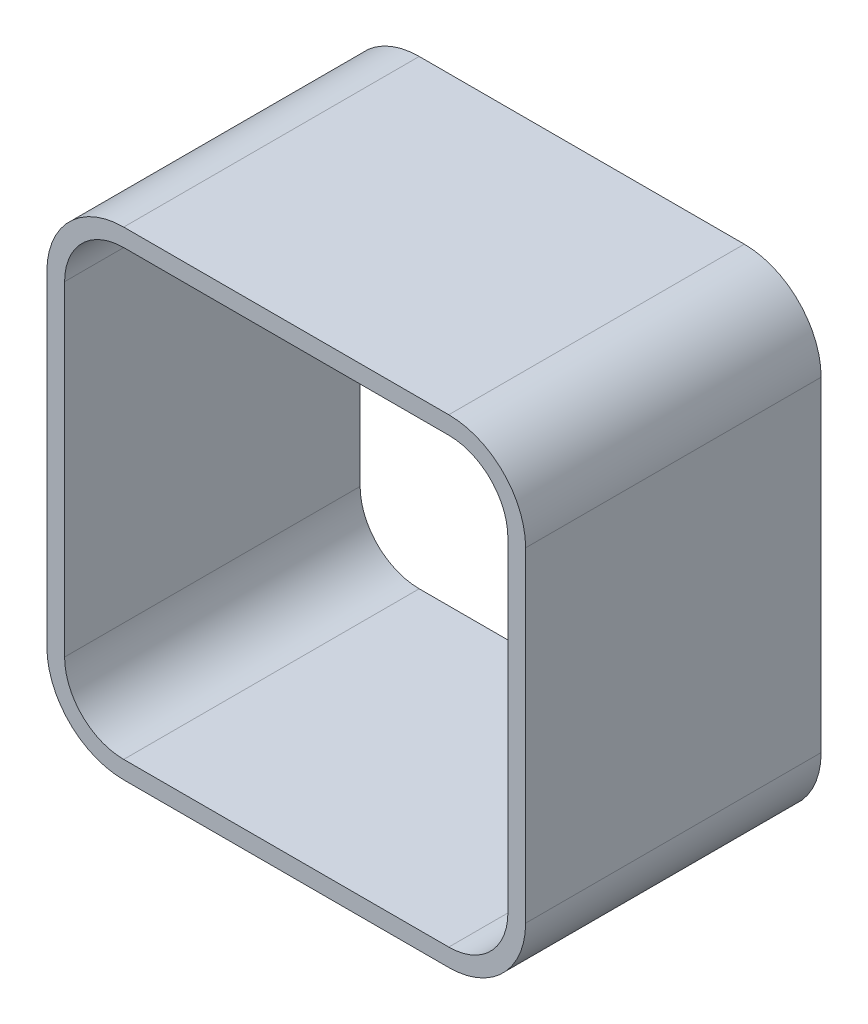
from build123d import *

# Parameters (mm, degrees)
SKETCH1_W           = 16.2
SKETCH1_H           = 16.2
SKETCH1_W_2         = 15
SKETCH1_H_2         = 15
BOSS_EXTRUDE1_DEPTH = 10
FILLET1_R           = 2
FILLET2_R           = 2.6


with BuildPart() as part:
    # Sketch1 → Boss-Extrude1 (new body)
    with BuildSketch(Plane.XY):
        Rectangle(SKETCH1_W, SKETCH1_H)
        Rectangle(SKETCH1_W_2, SKETCH1_H_2, mode=Mode.SUBTRACT)
    extrude(amount=BOSS_EXTRUDE1_DEPTH)

    # Fillet1
    fillet1_edges = [part.edges().sort_by_distance(p)[0] for p in [
        (7.5, -7.5, 5),
        (7.5, 7.5, 5),
        (-7.5, 7.5, 5),
        (-7.5, -7.5, 5),
    ]]
    fillet(fillet1_edges, radius=FILLET1_R)

    # Fillet2
    fillet2_edges = [part.edges().sort_by_distance(p)[0] for p in [
        (8.1, -8.1, 5),
        (-8.1, -8.1, 5),
        (-8.1, 8.1, 5),
        (8.1, 8.1, 5),
    ]]
    fillet(fillet2_edges, radius=FILLET2_R)


solid = part.part
